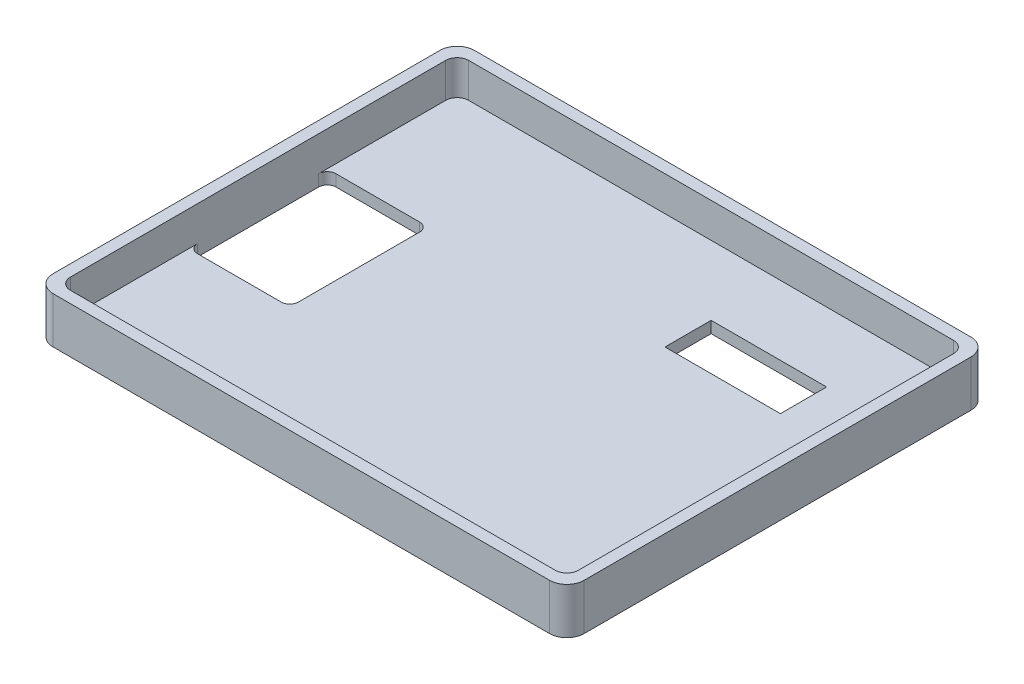
from build123d import *

# Parameters (mm, degrees)
SKETCH1_W           = 10
SKETCH1_H           = 4
BOSS_EXTRUDE1_DEPTH = 1
BOSS_EXTRUDE2_DEPTH = 4


with BuildPart() as part:
    # Sketch1 → Boss-Extrude1 (new body)
    with BuildSketch(Plane(origin=(0, 0, 0), x_dir=(1, 0, 0), z_dir=(0, 1, 0))):
        with BuildLine():
            Line((8.75, 22.5), (8.75, 12))
            ThreePointArc((8.75, 12), (8.530330086, 11.469669914), (8, 11.25))
            Line((8, 11.25), (0.75, 11.25))
            ThreePointArc((0.75, 11.25), (0.219669914, 11.469669914), (0, 12))
            Line((0, 12), (0, 1))
            ThreePointArc((0, 1), (0.292893219, 0.292893219), (1, 0))
            Line((1, 0), (43, 0))
            ThreePointArc((43, 0), (43.707106781, 0.292893219), (44, 1))
            Line((44, 1), (44, 33.5))
            ThreePointArc((44, 33.5), (43.707106781, 34.207106781), (43, 34.5))
            Line((43, 34.5), (1, 34.5))
            ThreePointArc((1, 34.5), (0.292893219, 34.207106781), (0, 33.5))
            Line((0, 33.5), (0, 22.5))
            ThreePointArc((0, 22.5), (0.219669914, 23.030330086), (0.75, 23.25))
            Line((0.75, 23.25), (8, 23.25))
            ThreePointArc((8, 23.25), (8.530330086, 23.030330086), (8.75, 22.5))
        make_face()
        with Locations((33, 26.5)):
            Rectangle(SKETCH1_W, SKETCH1_H, mode=Mode.SUBTRACT)
    extrude(amount=BOSS_EXTRUDE1_DEPTH)

    # Sketch1<3> → Boss-Extrude2 (add)
    with BuildSketch(Plane(origin=(0, 0, 0), x_dir=(1, 0, 0), z_dir=(0, 1, 0))):
        with BuildLine():
            ThreePointArc((-1, 0.5), (-0.560660172, -0.560660172), (0.5, -1))
            Line((0.5, -1), (43.5, -1))
            ThreePointArc((43.5, -1), (44.560660172, -0.560660172), (45, 0.5))
            Line((45, 0.5), (45, 34))
            ThreePointArc((45, 34), (44.560660172, 35.060660172), (43.5, 35.5))
            Line((43.5, 35.5), (0.5, 35.5))
            ThreePointArc((0.5, 35.5), (-0.560660172, 35.060660172), (-1, 34))
            Line((-1, 34), (-1, 0.5))
        make_face()
        with BuildLine():
            Line((43, 0), (1, 0))
            ThreePointArc((1, 0), (0.292893219, 0.292893219), (0, 1))
            Line((0, 1), (0, 9.75))
            Line((0, 9.75), (0, 12))
            Line((0, 12), (0, 22.5))
            Line((0, 22.5), (0, 24.75))
            Line((0, 24.75), (0, 33.5))
            ThreePointArc((0, 33.5), (0.292893219, 34.207106781), (1, 34.5))
            Line((1, 34.5), (43, 34.5))
            ThreePointArc((43, 34.5), (43.707106781, 34.207106781), (44, 33.5))
            Line((44, 33.5), (44, 1))
            ThreePointArc((44, 1), (43.707106781, 0.292893219), (43, 0))
        make_face(mode=Mode.SUBTRACT)
    extrude(amount=BOSS_EXTRUDE2_DEPTH)


solid = part.part
